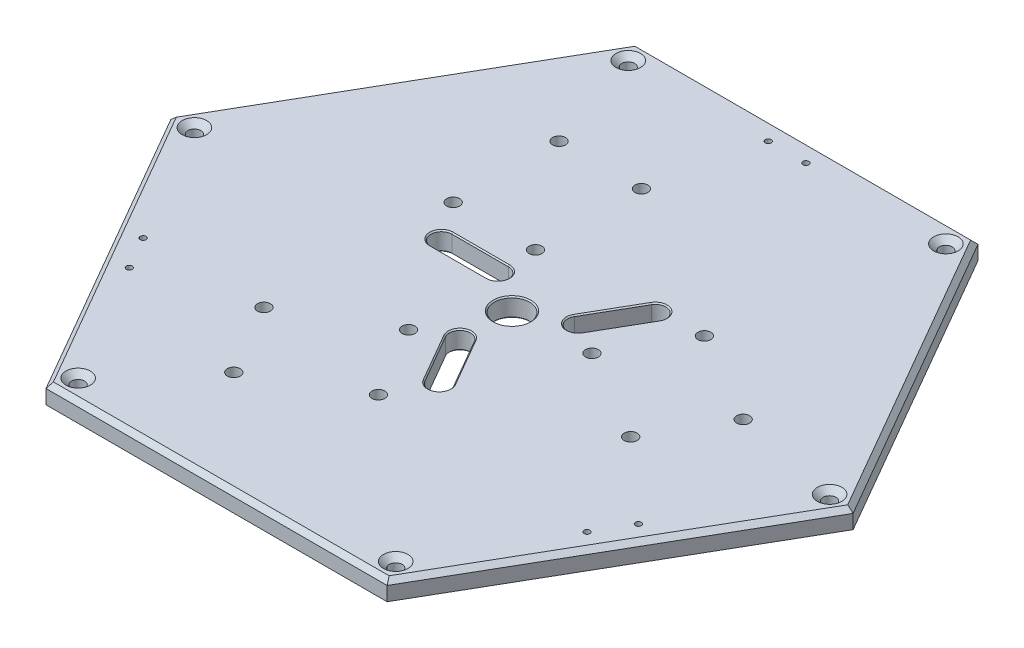
from build123d import *

# Parameters (mm, degrees)
BOSS_EXTRUDE1_DEPTH                             = 8
SKETCH5_R                                       = 7.5
CUT_EXTRUDE1_DEPTH                              = 192.983723268
CSK_FOR_M5_FLAT_HEAD_MACHINE_SCREW1_D           = 5.5
CSK_FOR_M5_FLAT_HEAD_MACHINE_SCREW1_CSINK_D     = 10.4
CSK_FOR_M5_FLAT_HEAD_MACHINE_SCREW1_CSINK_ANGLE = 90
CUT_EXTRUDE3_DEPTH                              = 192.983723268
CSK_FOR_M5_FLAT_HEAD_MACHINE_SCREW2_D           = 5.5
CSK_FOR_M5_FLAT_HEAD_MACHINE_SCREW2_DEPTH       = 10
CSK_FOR_M5_FLAT_HEAD_MACHINE_SCREW2_CSINK_D     = 10.4
CSK_FOR_M5_FLAT_HEAD_MACHINE_SCREW2_CSINK_ANGLE = 90
CSK_FOR_M5_FLAT_HEAD_MACHINE_SCREW2_TIP         = 1.652366702
CHAMFER1_SIZE                                   = 0.5
CHAMFER3_SIZE                                   = 0.5
CHAMFER4_SIZE                                   = 2
M3X0_5_TAPPED_HOLE1_D                           = 2.5


with BuildPart() as part:
    # Sketch1 → Boss-Extrude1 (new body)
    with BuildSketch(Plane(origin=(0, 0, 0), x_dir=(1, 0, 0), z_dir=(0, 1, 0))):
        Polygon((72.5, 125.573683549), (-72.5, 125.573683549), (-145, 0), (-72.5, -125.573683549), (72.5, -125.573683549), (145, 0), align=None)
    extrude(amount=BOSS_EXTRUDE1_DEPTH)

    # Sketch5 → Cut-Extrude1 (cut, through all)
    with BuildSketch(Plane(origin=(0, 8, 0), x_dir=(1, 0, 0), z_dir=(0, 1, 0))):
        with Locations(Location((0, 0, 0), (0, 0, 270))):
            Circle(SKETCH5_R)
    extrude(amount=-CUT_EXTRUDE1_DEPTH, mode=Mode.SUBTRACT)

    # CSK for M5 Flat Head Machine Screw1 (through all)
    with Locations(Plane(origin=(0, 0, 0), x_dir=(-1, 0, 0), z_dir=(0, -1, 0))):
        with Locations((52.5, 27.5), (17.5, 27.5), (17.5, 72.5), (52.5, 72.5), (-32.565698604, 1.405444566), (-71.536841774, -21.094555434), (-89.036841774, 9.216333699), (-50.065698604, 31.716333699), (15.065698604, -28.905444566), (-2.434301396, -59.216333699), (36.536841774, -81.716333699), (54.036841774, -51.405444566)):
            CounterSinkHole(CSK_FOR_M5_FLAT_HEAD_MACHINE_SCREW1_D / 2, CSK_FOR_M5_FLAT_HEAD_MACHINE_SCREW1_CSINK_D / 2, counter_sink_angle=CSK_FOR_M5_FLAT_HEAD_MACHINE_SCREW1_CSINK_ANGLE)

    # Sketch9 → Cut-Extrude3 (cut, through all)
    with BuildSketch(Plane.XZ):
        with BuildLine():
            Line((26.812177826, -32.440054257), (14.812177826, -11.655444566))
            ThreePointArc((14.812177826, -11.655444566), (16.459292144, -5.508330249), (22.606406461, -7.155444566))
            Line((22.606406461, -7.155444566), (34.606406461, -27.940054257))
            ThreePointArc((34.606406461, -27.940054257), (32.959292144, -34.087168574), (26.812177826, -32.440054257))
        make_face()
        with BuildLine():
            Line((-41.5, -7), (-17.5, -7))
            ThreePointArc((-17.5, -7), (-13, -11.5), (-17.5, -16))
            Line((-17.5, -16), (-41.5, -16))
            ThreePointArc((-41.5, -16), (-46, -11.5), (-41.5, -7))
        make_face()
        with BuildLine():
            Line((14.687822174, 39.440054257), (2.687822174, 18.655444566))
            ThreePointArc((2.687822174, 18.655444566), (-3.459292144, 17.008330249), (-5.106406461, 23.155444566))
            Line((-5.106406461, 23.155444566), (6.893593539, 43.940054257))
            ThreePointArc((6.893593539, 43.940054257), (13.040707856, 45.587168574), (14.687822174, 39.440054257))
        make_face()
    extrude(amount=-CUT_EXTRUDE3_DEPTH, mode=Mode.SUBTRACT)

    # CSK for M5 Flat Head Machine Screw2
    with Locations(Plane(origin=(0, 8, 0), x_dir=(1, 0, 0), z_dir=(0, 1, 0))):
        with Locations((-135, 0), (-67.5, -116.913429511), (67.5, -116.913429511), (135, 0), (67.5, 116.913429511), (-67.5, 116.913429511)):
            CounterSinkHole(CSK_FOR_M5_FLAT_HEAD_MACHINE_SCREW2_D / 2, CSK_FOR_M5_FLAT_HEAD_MACHINE_SCREW2_CSINK_D / 2, depth=CSK_FOR_M5_FLAT_HEAD_MACHINE_SCREW2_DEPTH, counter_sink_angle=CSK_FOR_M5_FLAT_HEAD_MACHINE_SCREW2_CSINK_ANGLE)
            with Locations((0, 0, -(CSK_FOR_M5_FLAT_HEAD_MACHINE_SCREW2_DEPTH + CSK_FOR_M5_FLAT_HEAD_MACHINE_SCREW2_TIP / 2))):  # 118° drill point
                Cone(0, CSK_FOR_M5_FLAT_HEAD_MACHINE_SCREW2_D / 2, CSK_FOR_M5_FLAT_HEAD_MACHINE_SCREW2_TIP, mode=Mode.SUBTRACT)

    # Chamfer1
    chamfer1_edges = [part.edges().sort_by_distance(p)[0] for p in [
        (32.959292144, 8, -34.087168574),
        (20.812177826, 8, -22.047749412),
        (16.459292144, 8, -5.508330249),
        (28.606406461, 8, -17.547749412),
        (32.959292144, 0, -34.087168574),
        (28.606406461, 0, -17.547749412),
        (16.459292144, 0, -5.508330249),
        (20.812177826, 0, -22.047749412),
        (-46, 8, -11.5),
        (-29.5, 8, -7),
        (-13, 8, -11.5),
        (-29.5, 8, -16),
        (-46, 0, -11.5),
        (-29.5, 0, -16),
        (-13, 0, -11.5),
        (-29.5, 0, -7),
        (13.040707856, 8, 45.587168574),
        (8.687822174, 8, 29.047749412),
        (-3.459292144, 8, 17.008330249),
        (0.893593539, 8, 33.547749412),
        (13.040707856, 0, 45.587168574),
        (0.893593539, 0, 33.547749412),
        (-3.459292144, 0, 17.008330249),
        (8.687822174, 0, 29.047749412),
    ]]
    chamfer(chamfer1_edges, length=CHAMFER1_SIZE)

    # Chamfer3
    chamfer3_edges = [part.edges().sort_by_distance(p)[0] for p in [
        (0, 0, -7.5),
        (0, 8, -7.5),
    ]]
    chamfer(chamfer3_edges, length=CHAMFER3_SIZE)

    # Chamfer4
    chamfer4_edges = [part.edges().sort_by_distance(p)[0] for p in [
        (-108.75, 8, -62.786841774),
        (-108.75, 8, 62.786841774),
        (0, 8, 125.573683549),
        (108.75, 8, 62.786841774),
        (108.75, 8, -62.786841774),
        (0, 8, -125.573683549),
    ]]
    chamfer(chamfer4_edges, length=CHAMFER4_SIZE)

    # M3x0.5 Tapped Hole1 (through all)
    with Locations(Plane(origin=(0, 8, 0), x_dir=(1, 0, 0), z_dir=(0, 1, 0))):
        with Locations((97.25, -65.384917986), (105.25, -51.528511525), (8, 116.913429511), (-8, 116.913429511), (-105.25, -51.528511525), (-97.25, -65.384917986)):
            Hole(M3X0_5_TAPPED_HOLE1_D / 2)


solid = part.part
